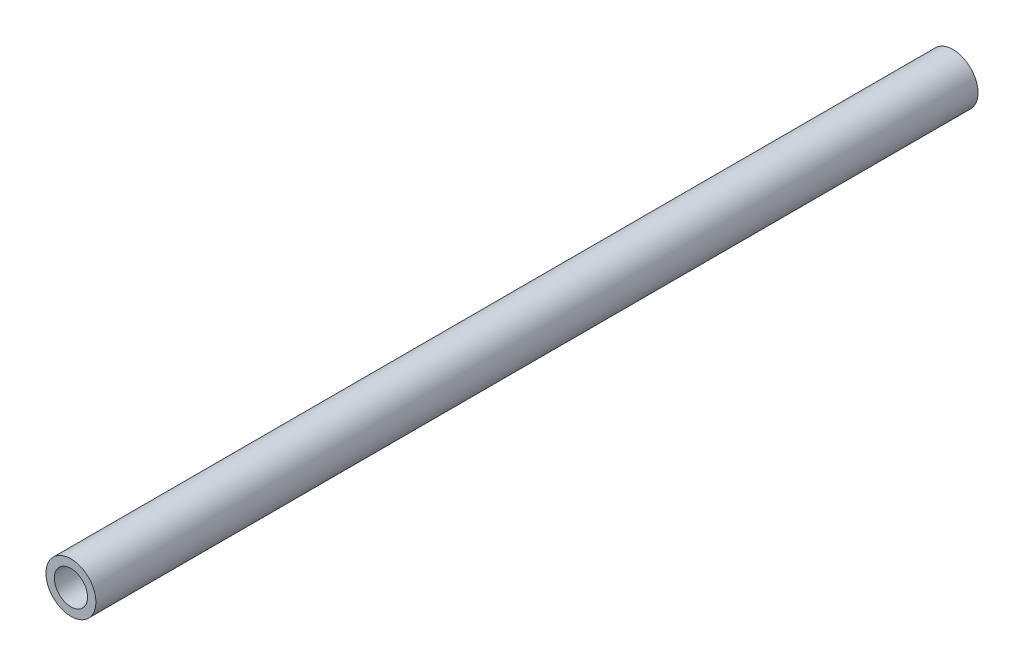
from build123d import *

# Parameters (mm, degrees)
SKETCH1_R           = 7.5
SKETCH1_R_2         = 5
BOSS_EXTRUDE1_DEPTH = 265


with BuildPart() as part:
    # Sketch1 → Boss-Extrude1 (new body)
    with BuildSketch(Plane.XY):
        Circle(SKETCH1_R)
        Circle(SKETCH1_R_2, mode=Mode.SUBTRACT)
    extrude(amount=BOSS_EXTRUDE1_DEPTH)


solid = part.part
